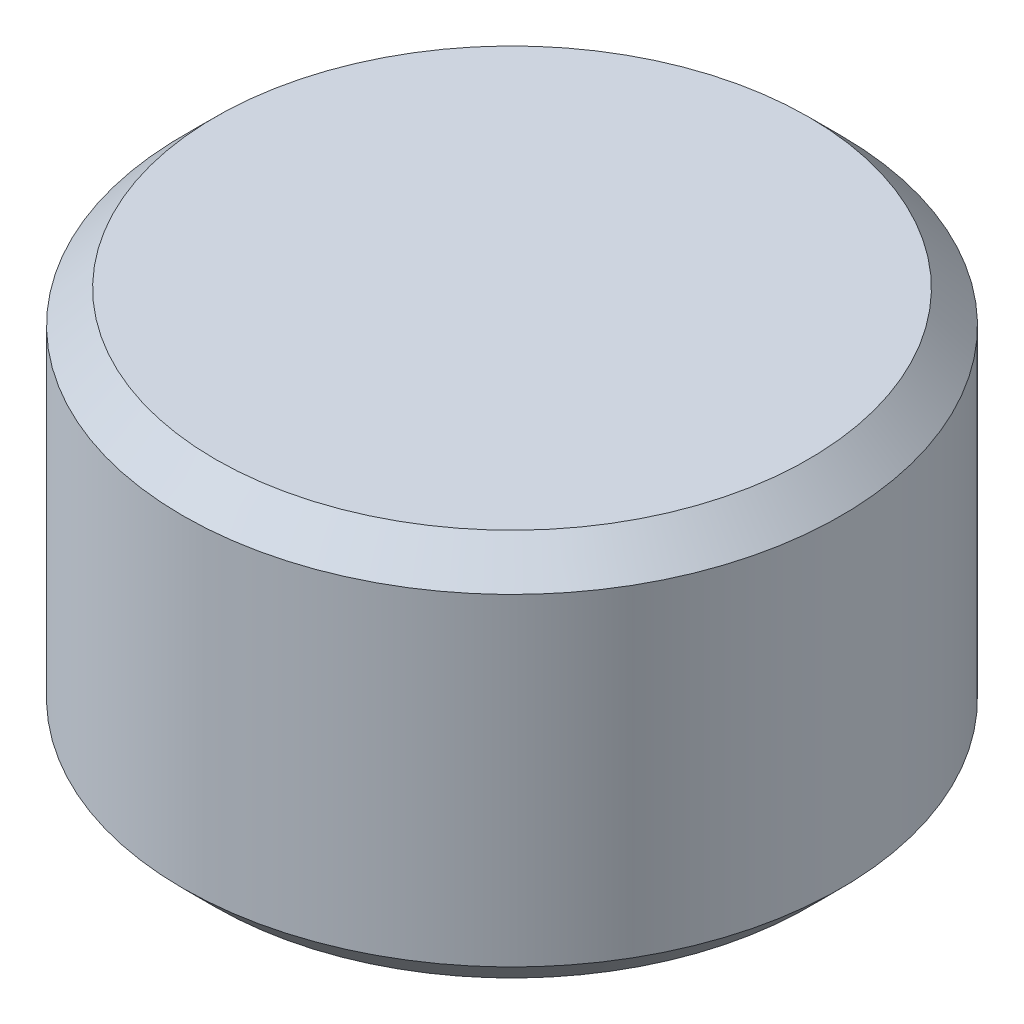
from build123d import *

# Parameters (mm, degrees)
SKETCH1_R           = 10.1
BOSS_EXTRUDE1_DEPTH = 11.9
SKETCH1_4_R         = 1.6
CUT_EXTRUDE1_DEPTH  = 6
CHAMFER1_SIZE       = 1


with BuildPart() as part:
    # Sketch1 → Boss-Extrude1 (new body)
    with BuildSketch(Plane(origin=(0, 0, 0), x_dir=(1, 0, 0), z_dir=(0, 1, 0))):
        Circle(SKETCH1_R)
    extrude(amount=BOSS_EXTRUDE1_DEPTH)

    # Sketch1<4> → Cut-Extrude1 (cut)
    with BuildSketch(Plane(origin=(0, 0, 0), x_dir=(1, 0, 0), z_dir=(0, 1, 0))):
        Circle(SKETCH1_4_R)
    extrude(amount=CUT_EXTRUDE1_DEPTH, mode=Mode.SUBTRACT)

    # Chamfer1
    chamfer1_edges = [part.edges().sort_by_distance(p)[0] for p in [
        (-10.1, 11.9, 0),
        (-10.1, 0, 0),
    ]]
    chamfer(chamfer1_edges, length=CHAMFER1_SIZE)


solid = part.part
